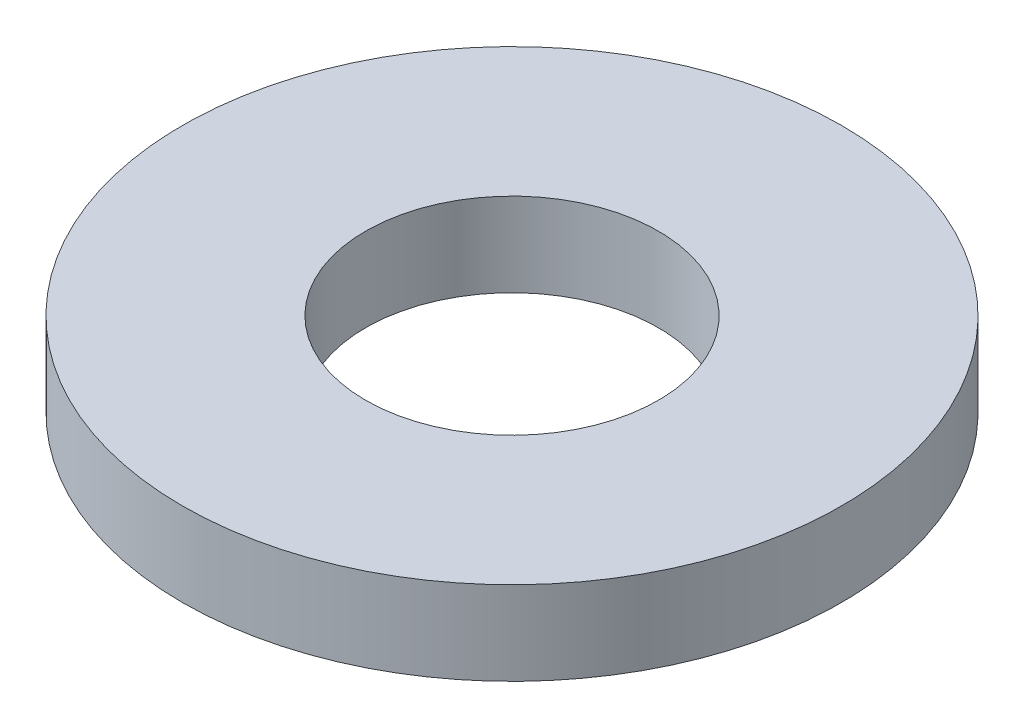
from build123d import *

# Parameters (mm, degrees)
SKETCH1_R           = 8.001
BOSS_EXTRUDE1_DEPTH = 2.032
SKETCH5_R           = 3.556
CUT_EXTRUDE1_DEPTH  = 12.496130914


with BuildPart() as part:
    # Sketch1 → Boss-Extrude1 (new body)
    with BuildSketch(Plane(origin=(0, 0, 0), x_dir=(1, 0, 0), z_dir=(0, 1, 0))):
        with Locations(Location((0, 0, 0), (0, 0, 270))):
            Circle(SKETCH1_R)
    extrude(amount=BOSS_EXTRUDE1_DEPTH)

    # Sketch5 → Cut-Extrude1 (cut, through all)
    with BuildSketch(Plane(origin=(0, 2.032, 0), x_dir=(-1, 0, 0), z_dir=(0, 1, 0))):
        with Locations(Location((0, 0, 0), (0, 0, 90))):
            Circle(SKETCH5_R)
    extrude(amount=-CUT_EXTRUDE1_DEPTH, mode=Mode.SUBTRACT)


solid = part.part
